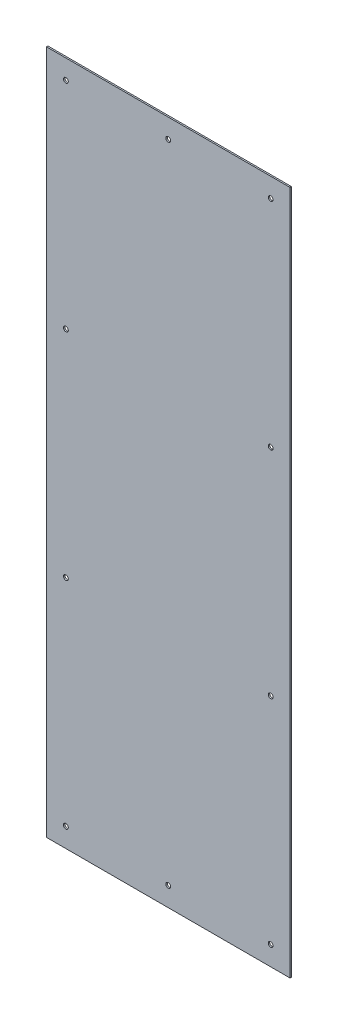
from build123d import *

# Parameters (mm, degrees)
CROQUIS1_W              = 320
CROQUIS1_H              = 900
SALIENTE_EXTRUIR1_DEPTH = 1.9
CROQUIS2_R              = 3.175
CORTAR_EXTRUIR1_DEPTH   = 10


with BuildPart() as part:
    # Croquis1 → Saliente-Extruir1 (new body)
    with BuildSketch(Plane.XY):
        Rectangle(CROQUIS1_W, CROQUIS1_H)
    extrude(amount=SALIENTE_EXTRUIR1_DEPTH)

    # Croquis2 → Cortar-Extruir1 (cut)
    with BuildSketch(Plane.XY.offset(1.9)):
        with Locations((-134.6, 424.6)):
            Circle(CROQUIS2_R)
        with Locations((134.6, 424.6)):
            Circle(CROQUIS2_R)
        with Locations((134.6, -424.6)):
            Circle(CROQUIS2_R)
        with Locations((-134.6, -424.6)):
            Circle(CROQUIS2_R)
        with Locations((-134.6, 141.54)):
            Circle(CROQUIS2_R)
        with Locations((-134.6, -141.52)):
            Circle(CROQUIS2_R)
        with Locations((134.6, 141.54)):
            Circle(CROQUIS2_R)
        with Locations((134.6, -141.52)):
            Circle(CROQUIS2_R)
        with Locations((0, 424.6)):
            Circle(CROQUIS2_R)
        with Locations((0, -424.6)):
            Circle(CROQUIS2_R)
    extrude(amount=-CORTAR_EXTRUIR1_DEPTH, mode=Mode.SUBTRACT)


solid = part.part
